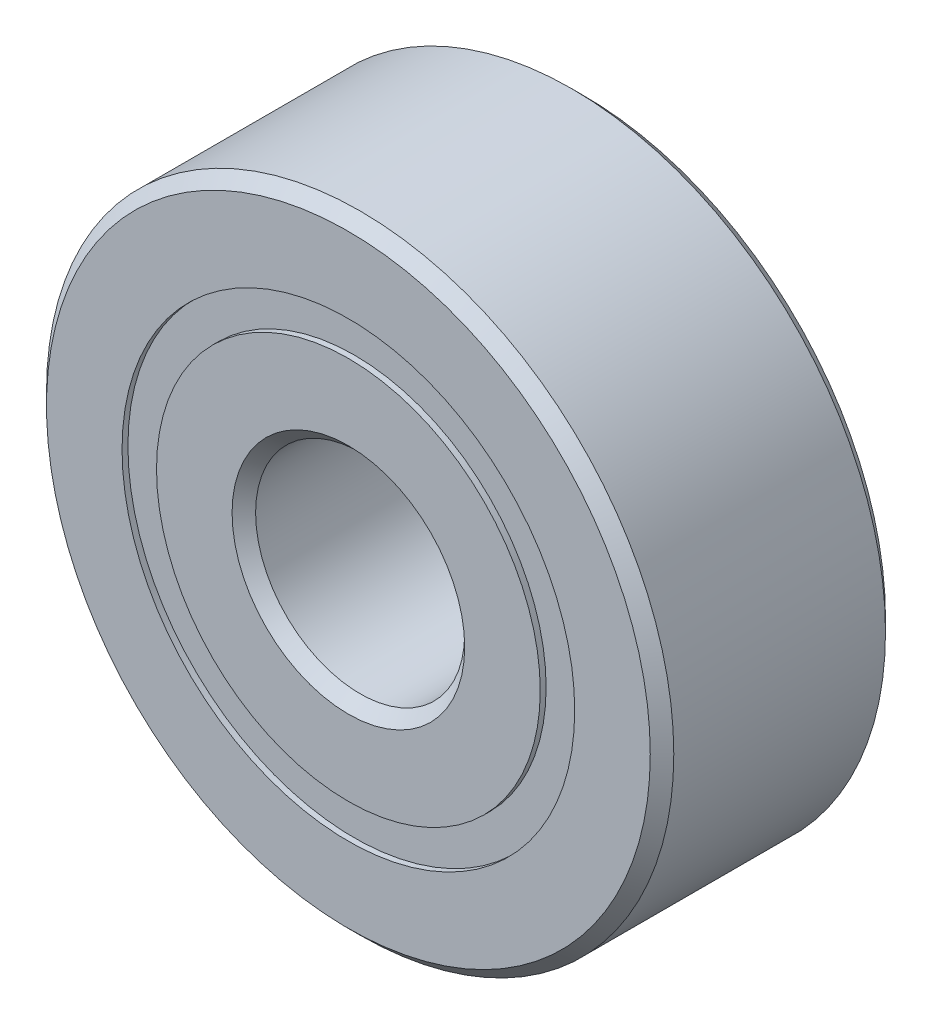
from build123d import *

# Parameters (mm, degrees)
CIRPATTERN1_COUNT = 8
SKETCH5_W         = 1.721739088
SKETCH5_H         = 1.046703296


with BuildPart() as part:
    # Sketch1 → Revolve1 (revolve)
    with BuildSketch(Plane(origin=(0, 0, 0), x_dir=(0, 0, -1), z_dir=(1, 0, 0)), mode=Mode.PRIVATE) as revolve1_sk:
        with BuildLine():
            Line((3.2146875, 9.525), (-3.2146875, 9.525))
            Line((-3.2146875, 9.525), (-3.571875, 9.1678125))
            Line((-3.571875, 9.1678125), (-3.571875, 6.873351648))
            Line((-3.571875, 6.873351648), (-1.5875, 6.873351648))
            ThreePointArc((-1.5875, 6.873351648), (0, 8.021542162), (1.5875, 6.873351648))
            Line((1.5875, 6.873351648), (3.571875, 6.873351648))
            Line((3.571875, 6.873351648), (3.571875, 9.1678125))
            Line((3.571875, 9.1678125), (3.2146875, 9.525))
        make_face()
    revolve(revolve1_sk.sketch.rotate(Axis((0, 0, 3.571875), (0, 0, -1)), 90), axis=Axis((0, 0, 3.571875), (0, 0, -1)))


with BuildPart() as body_2:
    # Sketch3 → Revolve3 (revolve)
    with BuildSketch(Plane(origin=(0, 0, 0), x_dir=(0, 0, -1), z_dir=(1, 0, 0)), mode=Mode.PRIVATE) as revolve3_sk:
        with BuildLine():
            Line((-3.571875, 5.826648352), (-1.5875, 5.826648352))
            ThreePointArc((-1.5875, 5.826648352), (0, 4.678457838), (1.5875, 5.826648352))
            Line((1.5875, 5.826648352), (3.571875, 5.826648352))
            Line((3.571875, 5.826648352), (3.571875, 3.5321875))
            Line((3.571875, 3.5321875), (3.2146875, 3.175))
            Line((3.2146875, 3.175), (-3.2146875, 3.175))
            Line((-3.2146875, 3.175), (-3.571875, 3.5321875))
            Line((-3.571875, 3.5321875), (-3.571875, 5.826648352))
        make_face()
    revolve(revolve3_sk.sketch.rotate(Axis((0, 0, 3.571875), (0, 0, -1)), 90), axis=Axis((0, 0, 3.571875), (0, 0, -1)))


with BuildPart() as body_3:
    # Sketch4 → Revolve4 (revolve)
    with BuildSketch(Plane(origin=(0, 0, 0), x_dir=(0, 0, -1), z_dir=(1, 0, 0))):
        with BuildLine():
            Line((-1.671542162, 6.35), (1.671542162, 6.35))
            ThreePointArc((1.671542162, 6.35), (0, 8.021542162), (-1.671542162, 6.35))
        make_face()
    revolve(axis=Axis((0, 6.35, 1.671542162), (0, 0, -1)))


with BuildPart() as cirpattern1_1:
    # CirPattern1: pattern copy
    add(body_3.part.rotate(Axis((0, 0, 0), (0, 0, 1)), 1 * 360 / CIRPATTERN1_COUNT))


with BuildPart() as cirpattern1_2:
    # CirPattern1: pattern copy
    add(body_3.part.rotate(Axis((0, 0, 0), (0, 0, 1)), 2 * 360 / CIRPATTERN1_COUNT))


with BuildPart() as cirpattern1_3:
    # CirPattern1: pattern copy
    add(body_3.part.rotate(Axis((0, 0, 0), (0, 0, 1)), 3 * 360 / CIRPATTERN1_COUNT))


with BuildPart() as cirpattern1_4:
    # CirPattern1: pattern copy
    add(body_3.part.rotate(Axis((0, 0, 0), (0, 0, 1)), 4 * 360 / CIRPATTERN1_COUNT))


with BuildPart() as cirpattern1_5:
    # CirPattern1: pattern copy
    add(body_3.part.rotate(Axis((0, 0, 0), (0, 0, 1)), 5 * 360 / CIRPATTERN1_COUNT))


with BuildPart() as cirpattern1_6:
    # CirPattern1: pattern copy
    add(body_3.part.rotate(Axis((0, 0, 0), (0, 0, 1)), 6 * 360 / CIRPATTERN1_COUNT))


with BuildPart() as cirpattern1_7:
    # CirPattern1: pattern copy
    add(body_3.part.rotate(Axis((0, 0, 0), (0, 0, 1)), 7 * 360 / CIRPATTERN1_COUNT))


with BuildPart() as body_11:
    # Sketch5 → Revolve5 (revolve)
    with BuildSketch(Plane(origin=(0, 0, 0), x_dir=(0, 0, -1), z_dir=(1, 0, 0)), mode=Mode.PRIVATE) as revolve5_sk:
        with Locations((-2.532411706, 6.35)):
            Rectangle(SKETCH5_W, SKETCH5_H)
        with Locations((2.532411706, 6.35)):
            Rectangle(SKETCH5_W, SKETCH5_H)
    revolve(revolve5_sk.sketch.rotate(Axis((0, 0, 3.571875), (0, 0, -1)), 90), axis=Axis((0, 0, 3.571875), (0, 0, -1)))


solid = Compound([part.part, body_2.part, body_3.part, cirpattern1_1.part, cirpattern1_2.part, cirpattern1_3.part, cirpattern1_4.part, cirpattern1_5.part, cirpattern1_6.part, cirpattern1_7.part, body_11.part])
